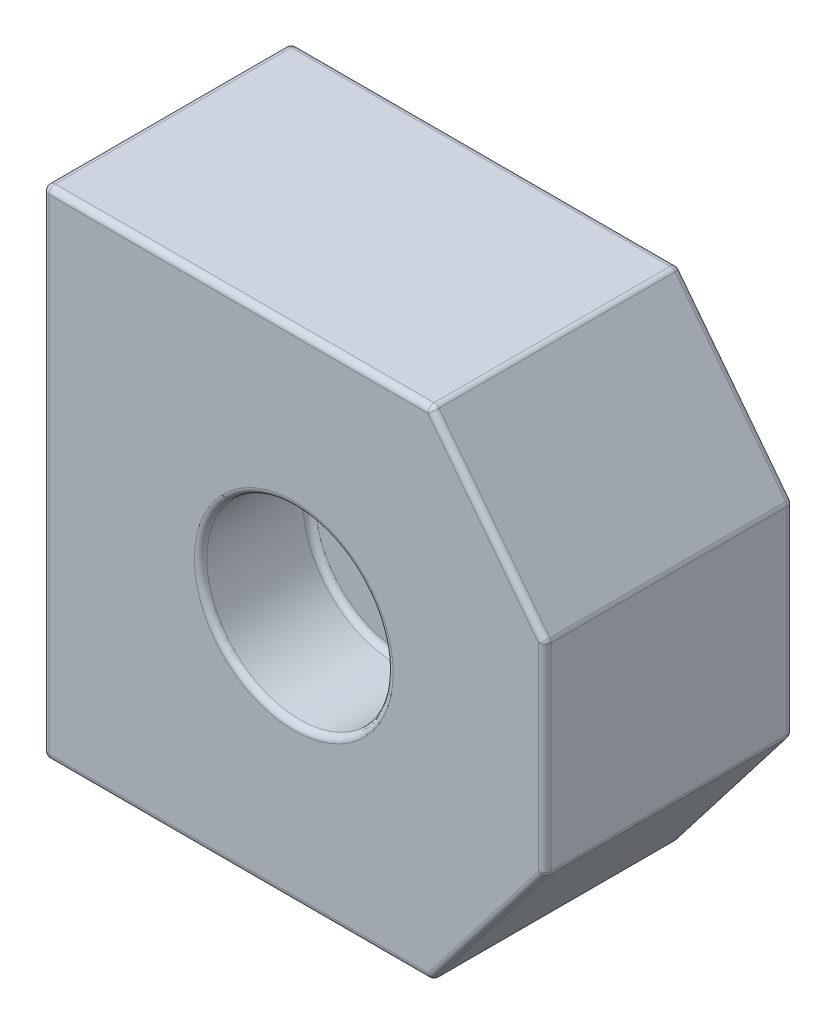
from build123d import *

# Parameters (mm, degrees)
BOSS_EXTRUDE1_DEPTH = 16
SKETCH4_R           = 6
CUT_EXTRUDE1_DEPTH  = 7
SKETCH5_R           = 3.2
CUT_EXTRUDE2_DEPTH  = 11
FILLET1_R           = 0.4


with BuildPart() as part:
    # Sketch3 → Boss-Extrude1 (new body)
    with BuildSketch(Plane.XY):
        Polygon((0, 0), (0, -32), (25, -32), (32.331439149, -22.5), (32.331439149, -9.5), (25, 0), align=None)
    extrude(amount=BOSS_EXTRUDE1_DEPTH)

    # Sketch4 → Cut-Extrude1 (cut)
    with BuildSketch(Plane.XY.offset(16)):
        with Locations((16.165719575, -16)):
            Circle(SKETCH4_R)
    extrude(amount=-CUT_EXTRUDE1_DEPTH, mode=Mode.SUBTRACT)

    # Sketch5 → Cut-Extrude2 (cut)
    with BuildSketch(Plane.XY.offset(9)):
        with Locations((16.165719575, -16)):
            Circle(SKETCH5_R)
    extrude(amount=-CUT_EXTRUDE2_DEPTH, mode=Mode.SUBTRACT)

    # Fillet1
    fillet1_edges = [part.edges().sort_by_distance(p)[0] for p in [
        (25, 0, 8),
        (32.331439149, -9.5, 8),
        (32.331439149, -22.5, 8),
        (25, -32, 8),
        (0, -32, 8),
        (0, 0, 8),
        (12.5, -32, 16),
        (28.665719575, -27.25, 16),
        (10.165719575, -16, 9),
        (10.165719575, -16, 16),
        (32.331439149, -16, 16),
        (28.665719575, -4.75, 16),
        (12.965719575, -16, 0),
        (12.965719575, -16, 9),
        (12.5, 0, 16),
        (28.665719575, -4.75, 0),
        (32.331439149, -16, 0),
        (28.665719575, -27.25, 0),
        (12.5, -32, 0),
        (0, -16, 0),
        (12.5, 0, 0),
        (0, -16, 16),
    ]]
    fillet(fillet1_edges, radius=FILLET1_R)


solid = part.part
